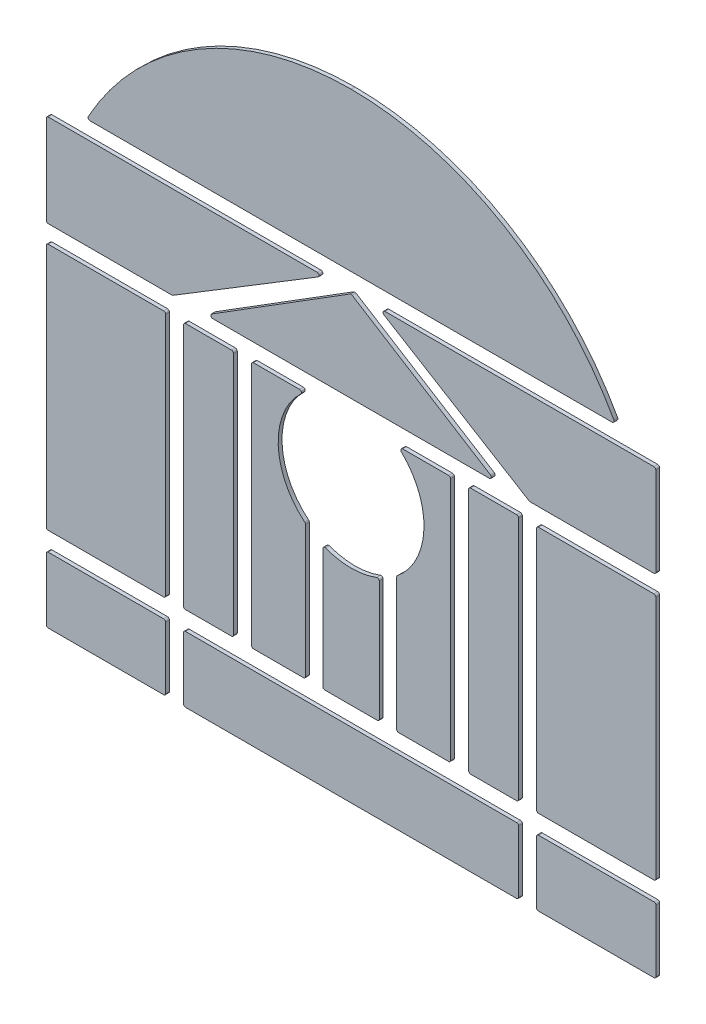
from build123d import *

# Parameters (mm, degrees)
SKETCH1_W              = 98.758926402
SKETCH1_H              = 54.392174278
BOSS_EXTRUDE1_DEPTH    = 3.175
SKETCH1_H_2            = 205.000109937
BOSS_EXTRUDE1_2_DEPTH  = 3.175
BOSS_EXTRUDE1_3_DEPTH  = 3.175
BOSS_EXTRUDE1_4_DEPTH  = 3.175
BOSS_EXTRUDE1_5_DEPTH  = 3.175
BOSS_EXTRUDE1_6_DEPTH  = 3.175
BOSS_EXTRUDE1_7_DEPTH  = 3.175
BOSS_EXTRUDE1_8_DEPTH  = 3.175
BOSS_EXTRUDE1_9_DEPTH  = 3.175
BOSS_EXTRUDE1_10_DEPTH = 3.175
BOSS_EXTRUDE1_11_DEPTH = 3.175
BOSS_EXTRUDE1_12_DEPTH = 3.175
BOSS_EXTRUDE1_13_DEPTH = 3.175
SKETCH1_W_2            = 41.254229691
BOSS_EXTRUDE1_14_DEPTH = 3.175
FILLET1_R              = 1.59004
FILLET2_R              = 1.59004
FILLET3_R              = 1.59004
FILLET4_R              = 1.59004
FILLET5_R              = 1.59004
FILLET6_R              = 1.59004
FILLET7_R              = 1.59004
FILLET8_R              = 1.59004
FILLET9_R              = 1.59004
FILLET10_R             = 1.59004
FILLET11_R             = 1.59004
FILLET12_R             = 1.59004
FILLET13_R             = 1.59004
FILLET14_R             = 1.59004


with BuildPart() as part:
    # Sketch1 → Boss-Extrude1 (new body)
    with BuildSketch(Plane.XY):
        with Locations((-455.034071493, 27.196087139)):
            Rectangle(SKETCH1_W, SKETCH1_H)
    extrude(amount=BOSS_EXTRUDE1_DEPTH)

    # Fillet6
    fillet6_edges = [part.edges().sort_by_distance(p)[0] for p in [
        (-405.654608292, 0, 1.5875),
        (-504.413534694, 0, 1.5875),
        (-504.413534694, 54.392174278, 1.5875),
        (-405.654608292, 54.392174278, 1.5875),
    ]]
    fillet(fillet6_edges, radius=FILLET6_R)


with BuildPart() as body_2:
    # Sketch1 → Boss-Extrude1 2 (new body)
    with BuildSketch(Plane.XY):
        with Locations((-455.034071493, 172.524349147)):
            Rectangle(SKETCH1_W, SKETCH1_H_2)
    extrude(amount=BOSS_EXTRUDE1_2_DEPTH)

    # Fillet5
    fillet5_edges = [body_2.edges().sort_by_distance(p)[0] for p in [
        (-405.654608292, 70.024294178, 1.5875),
        (-504.413534694, 70.024294178, 1.5875),
        (-504.413534694, 275.024404115, 1.5875),
        (-405.654608292, 275.024404115, 1.5875),
    ]]
    fillet(fillet5_edges, radius=FILLET5_R)


with BuildPart() as body_3:
    # Sketch1 → Boss-Extrude1 3 (new body)
    with BuildSketch(Plane.XY):
        Polygon((-504.413534694, 289.770723971), (-399.995536142, 289.770723971), (-274.637603852, 366.204129426), (-504.413534694, 366.204129426), align=None)
    extrude(amount=BOSS_EXTRUDE1_3_DEPTH)

    # Fillet4
    fillet4_edges = [body_3.edges().sort_by_distance(p)[0] for p in [
        (-504.413534694, 289.770723971, 1.5875),
        (-504.413534694, 366.204129426, 1.5875),
        (-274.637603852, 366.204129426, 1.5875),
        (-399.995536142, 289.770723971, 1.5875),
    ]]
    fillet(fillet4_edges, radius=FILLET4_R)


with BuildPart() as body_4:
    # Sketch1 → Boss-Extrude1 4 (new body)
    with BuildSketch(Plane.XY):
        with BuildLine():
            Line((-470.964837705, 380.745219948), (-33.532382457, 380.7932929))
            ThreePointArc((-33.532382457, 380.7932929), (-124.866998496, 476.303277883), (-252.262970294, 511.437814852))
            ThreePointArc((-252.262970294, 511.437814852), (-379.651216585, 476.275277607), (-470.964837705, 380.745219948))
        make_face()
    extrude(amount=BOSS_EXTRUDE1_4_DEPTH)

    # Fillet1
    fillet1_edges = [body_4.edges().sort_by_distance(p)[0] for p in [
        (-470.964837705, 380.745219948, 1.5875),
        (-33.532382457, 380.7932929, 1.5875),
    ]]
    fillet(fillet1_edges, radius=FILLET1_R)


with BuildPart() as body_5:
    # Sketch1 → Boss-Extrude1 5 (new body)
    with BuildSketch(Plane.XY):
        Polygon((-0.063690446, 289.82615101), (-0.080490203, 366.259554619), (-229.856415494, 366.209050789), (-104.481686476, 289.803200352), align=None)
    extrude(amount=BOSS_EXTRUDE1_5_DEPTH)

    # Fillet2
    fillet2_edges = [body_5.edges().sort_by_distance(p)[0] for p in [
        (-0.063690446, 289.82615101, 1.5875),
        (-104.481686476, 289.803200352, 1.5875),
        (-229.856415494, 366.209050789, 1.5875),
        (-0.080490203, 366.259554619, 1.5875),
    ]]
    fillet(fillet2_edges, radius=FILLET2_R)


with BuildPart() as body_6:
    # Sketch1 → Boss-Extrude1 6 (new body)
    with BuildSketch(Plane.XY):
        Polygon((-132.234892816, 289.797100308), (-252.246850325, 364.756625786), (-372.242329131, 289.770723971), align=None)
    extrude(amount=BOSS_EXTRUDE1_6_DEPTH)

    # Fillet3
    fillet3_edges = [body_6.edges().sort_by_distance(p)[0] for p in [
        (-132.234892816, 289.797100308, 1.5875),
        (-372.242329131, 289.770723971, 1.5875),
        (-252.246850325, 364.756625786, 1.5875),
    ]]
    fillet(fillet3_edges, radius=FILLET3_R)


with BuildPart() as body_7:
    # Sketch1 → Boss-Extrude1 7 (new body)
    with BuildSketch(Plane.XY):
        Polygon((-98.774315076, 70.058019709), (-0.01539106, 70.079726526), (-0.060449264, 275.079831511), (-98.81937328, 275.058124694), align=None)
    extrude(amount=BOSS_EXTRUDE1_7_DEPTH)

    # Fillet9
    fillet9_edges = [body_7.edges().sort_by_distance(p)[0] for p in [
        (-98.774315076, 70.058019709, 1.5875),
        (-98.81937328, 275.058124694, 1.5875),
        (-0.060449264, 275.079831511, 1.5875),
        (-0.01539106, 70.079726526, 1.5875),
    ]]
    fillet(fillet9_edges, radius=FILLET9_R)


with BuildPart() as body_8:
    # Sketch1 → Boss-Extrude1 8 (new body)
    with BuildSketch(Plane.XY):
        Polygon((-98.758924016, 0.033727222), (0, 0.055434039), (-0.011955182, 54.447607004), (-98.770879198, 54.425900187), align=None)
    extrude(amount=BOSS_EXTRUDE1_8_DEPTH)

    # Fillet8
    fillet8_edges = [body_8.edges().sort_by_distance(p)[0] for p in [
        (-98.758924016, 0.033727222, 1.5875),
        (-98.770879198, 54.425900187, 1.5875),
        (-0.011955182, 54.447607004, 1.5875),
        (0, 0.055434039, 1.5875),
    ]]
    fillet(fillet8_edges, radius=FILLET8_R)


with BuildPart() as body_9:
    # Sketch1 → Boss-Extrude1 9 (new body)
    with BuildSketch(Plane.XY):
        Polygon((-113.637483376, 54.422632566), (-390.788003755, 54.392174278), (-390.788003755, 0), (-113.625528194, 0.030459602), align=None)
    extrude(amount=BOSS_EXTRUDE1_9_DEPTH)

    # Fillet7
    fillet7_edges = [body_9.edges().sort_by_distance(p)[0] for p in [
        (-113.637483376, 54.422632566, 1.5875),
        (-113.625528194, 0.030459602, 1.5875),
        (-390.788003755, 0, 1.5875),
        (-390.788003755, 54.392174278, 1.5875),
    ]]
    fillet(fillet7_edges, radius=FILLET7_R)


with BuildPart() as body_10:
    # Sketch1 → Boss-Extrude1 10 (new body)
    with BuildSketch(Plane.XY):
        Polygon((-154.895147948, 70.045684574), (-113.640919254, 70.054752089), (-113.685977458, 275.054857074), (-154.940206152, 275.045789559), align=None)
    extrude(amount=BOSS_EXTRUDE1_10_DEPTH)

    # Fillet10
    fillet10_edges = [body_10.edges().sort_by_distance(p)[0] for p in [
        (-154.895147948, 70.045684574, 1.5875),
        (-154.940206152, 275.045789559, 1.5875),
        (-113.685977458, 275.054857074, 1.5875),
        (-113.640919254, 70.054752089, 1.5875),
    ]]
    fillet(fillet10_edges, radius=FILLET10_R)


with BuildPart() as body_11:
    # Sketch1 → Boss-Extrude1 11 (new body)
    with BuildSketch(Plane.XY):
        with BuildLine():
            ThreePointArc((-214.499514867, 181.512114455), (-191.883991823, 228.081593234), (-213.695808519, 275.032875312))
            Line((-213.695808519, 275.032875312), (-169.916399335, 275.042497851))
            Line((-169.916399335, 275.042497851), (-169.87134113, 70.042392867))
            Line((-169.87134113, 70.042392867), (-214.475012112, 70.032589158))
            Line((-214.475012112, 70.032589158), (-214.499514867, 181.512114455))
        make_face()
    extrude(amount=BOSS_EXTRUDE1_11_DEPTH)

    # Fillet11
    fillet11_edges = [body_11.edges().sort_by_distance(p)[0] for p in [
        (-213.695808519, 275.032875312, 1.5875),
        (-169.916399335, 275.042497851, 1.5875),
        (-169.87134113, 70.042392867, 1.5875),
        (-214.475012112, 70.032589158, 1.5875),
        (-214.499514867, 181.512114455, 1.5875),
    ]]
    fillet(fillet11_edges, radius=FILLET11_R)


with BuildPart() as body_12:
    # Sketch1 → Boss-Extrude1 12 (new body)
    with BuildSketch(Plane.XY):
        with BuildLine():
            ThreePointArc((-275.568925666, 172.982421472), (-252.227378583, 168.275003522), (-228.88261971, 172.966467809))
            Line((-228.88261971, 172.966467809), (-228.85999456, 70.029427396))
            Line((-228.85999456, 70.029427396), (-275.568925666, 70.024294178))
            Line((-275.568925666, 70.024294178), (-275.568925666, 172.982421472))
        make_face()
    extrude(amount=BOSS_EXTRUDE1_12_DEPTH)

    # Fillet12
    fillet12_edges = [body_12.edges().sort_by_distance(p)[0] for p in [
        (-228.88261971, 172.966467809, 1.5875),
        (-228.85999456, 70.029427396, 1.5875),
        (-275.568925666, 70.024294178, 1.5875),
        (-275.568925666, 172.982421472, 1.5875),
    ]]
    fillet(fillet12_edges, radius=FILLET12_R)


with BuildPart() as body_13:
    # Sketch1 → Boss-Extrude1 13 (new body)
    with BuildSketch(Plane.XY):
        with BuildLine():
            ThreePointArc((-290.727931568, 275.024404115), (-312.529696482, 228.100522185), (-289.953908461, 181.54408929))
            Line((-289.953908461, 181.54408929), (-289.953908461, 70.024294178))
            Line((-289.953908461, 70.024294178), (-334.55758052, 70.024294178))
            Line((-334.55758052, 70.024294178), (-334.55758052, 275.024404115))
            Line((-334.55758052, 275.024404115), (-290.727931568, 275.024404115))
        make_face()
    extrude(amount=BOSS_EXTRUDE1_13_DEPTH)

    # Fillet13
    fillet13_edges = [body_13.edges().sort_by_distance(p)[0] for p in [
        (-289.953908461, 181.54408929, 1.5875),
        (-289.953908461, 70.024294178, 1.5875),
        (-334.55758052, 70.024294178, 1.5875),
        (-334.55758052, 275.024404115, 1.5875),
        (-290.727931568, 275.024404115, 1.5875),
    ]]
    fillet(fillet13_edges, radius=FILLET13_R)


with BuildPart() as body_14:
    # Sketch1 → Boss-Extrude1 14 (new body)
    with BuildSketch(Plane.XY):
        with Locations((-370.16088891, 172.524349147)):
            Rectangle(SKETCH1_W_2, SKETCH1_H_2)
    extrude(amount=BOSS_EXTRUDE1_14_DEPTH)

    # Fillet14
    fillet14_edges = [body_14.edges().sort_by_distance(p)[0] for p in [
        (-349.533774064, 70.024294178, 1.5875),
        (-390.788003755, 70.024294178, 1.5875),
        (-390.788003755, 275.024404115, 1.5875),
        (-349.533774064, 275.024404115, 1.5875),
    ]]
    fillet(fillet14_edges, radius=FILLET14_R)


solid = Compound([part.part, body_2.part, body_3.part, body_4.part, body_5.part, body_6.part, body_7.part, body_8.part, body_9.part, body_10.part, body_11.part, body_12.part, body_13.part, body_14.part])
